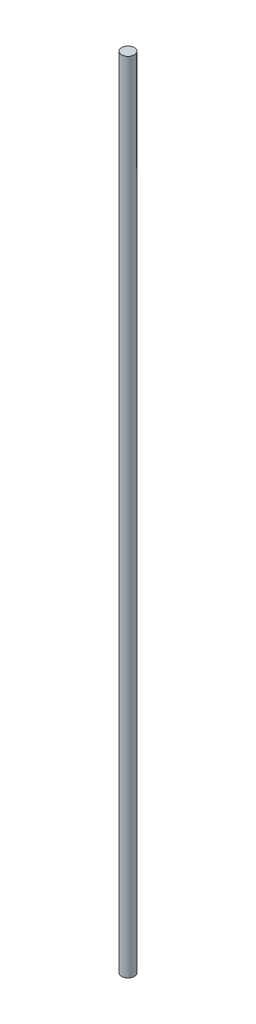
from build123d import *

# Parameters (mm, degrees)
SKETCH1_R           = 6
BOSS_EXTRUDE1_DEPTH = 755


with BuildPart() as part:
    # Sketch1 → Boss-Extrude1 (new body)
    with BuildSketch(Plane(origin=(0, 0, 0), x_dir=(1, 0, 0), z_dir=(0, 1, 0))):
        with Locations(Location((0, 0, 0), (0, 0, 270))):
            Circle(SKETCH1_R)
    extrude(amount=BOSS_EXTRUDE1_DEPTH)


solid = part.part
